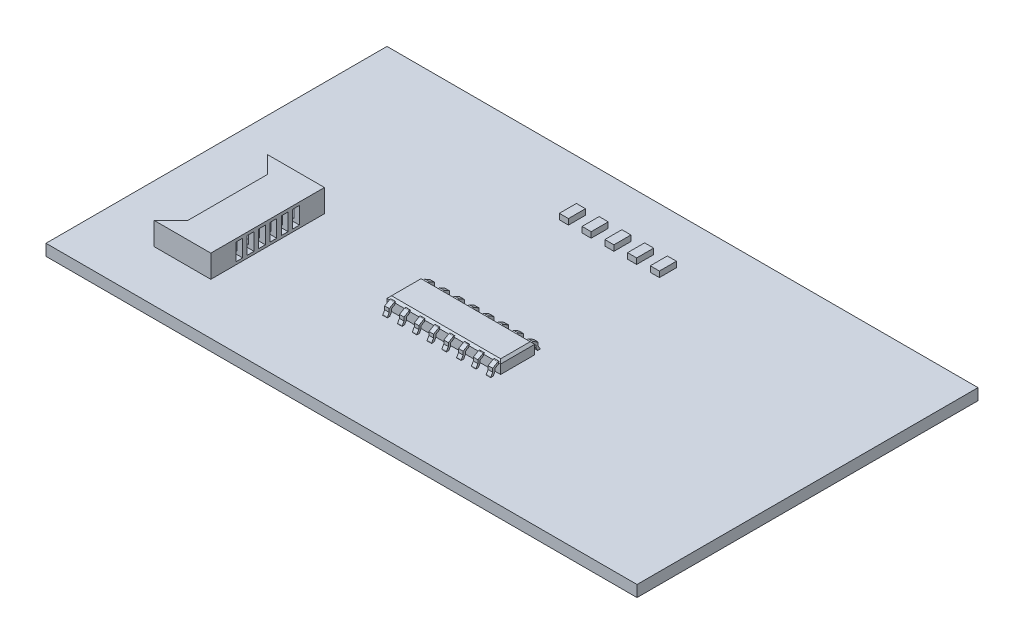
from build123d import *

# Parameters (mm, degrees)
SKETCH_1_W             = 52
SKETCH_1_H             = 30
EXTRUDE_1_DEPTH        = 1
SKETCH_2_W             = 5
SKETCH_2_H             = 10
EXTRUDE_2_DEPTH        = 2
SKETCH_4_W             = 8
SKETCH_4_H             = 1
CUT_EXTRUDE_1_DEPTH    = 4.5
CUT_EXTRUDE_2_DEPTH    = 1.5
SKETCH_5_W             = 0.6
SKETCH_5_H             = 1.5
CUT_EXTRUDE_3_DEPTH    = 6
SKETCH_6_W             = 10
SKETCH_6_H             = 3
EXTRUDE_3_DEPTH        = 1
CHAMFER_1_SIZE         = 0.2
EXTRUDE_4_DEPTH        = 0.2
EXTRUDE_4_DEPTH_BACK   = 0.2
PATTERN_LINEAR_1_COUNT = 8
PATTERN_LINEAR_1_PITCH = 1.3
SKETCH_8_W             = 0.8
SKETCH_8_H             = 1.5
EXTRUDE_5_DEPTH        = 0.5
PATTERN_LINEAR_2_COUNT = 5
PATTERN_LINEAR_2_PITCH = 2


with BuildPart() as part:
    # 草图1 → 凸台-拉伸1 (new body)
    with BuildSketch(Plane(origin=(0, 0, 0), x_dir=(1, 0, 0), z_dir=(0, 1, 0))):
        with Locations((26, 15)):
            Rectangle(SKETCH_1_W, SKETCH_1_H)
    extrude(amount=EXTRUDE_1_DEPTH)

    # 草图2 → 凸台-拉伸2 (add)
    with BuildSketch(Plane(origin=(0, 1, 0), x_dir=(1, 0, 0), z_dir=(0, 1, 0))):
        with Locations((7.5, 9.5)):
            Rectangle(SKETCH_2_W, SKETCH_2_H)
    extrude(amount=EXTRUDE_2_DEPTH)

    # 草图4 → 切除-拉伸1 (cut)
    with BuildSketch(Plane.ZY.offset(-5)):
        with Locations((-9.5, 2)):
            Rectangle(SKETCH_4_W, SKETCH_4_H)
    extrude(amount=-CUT_EXTRUDE_1_DEPTH, mode=Mode.SUBTRACT)

    # 草图3 → 切除-拉伸2 (cut)
    with BuildSketch(Plane(origin=(0, 3, 0), x_dir=(1, 0, 0), z_dir=(0, 1, 0))):
        Polygon((5, 14.5), (6.5, 13), (6.5, 6), (5, 4.5), align=None)
    extrude(amount=-CUT_EXTRUDE_2_DEPTH, mode=Mode.SUBTRACT)

    # 草图5 → 切除-拉伸3 (cut)
    with BuildSketch(Plane.ZY.offset(-5)):
        with Locations((-11, 1.985152132)):
            Rectangle(SKETCH_5_W, SKETCH_5_H)
        with Locations((-12, 1.985152132)):
            Rectangle(SKETCH_5_W, SKETCH_5_H)
        with Locations((-10, 1.985152132)):
            Rectangle(SKETCH_5_W, SKETCH_5_H)
        with Locations((-9, 1.985152132)):
            Rectangle(SKETCH_5_W, SKETCH_5_H)
        with Locations((-8, 1.985152132)):
            Rectangle(SKETCH_5_W, SKETCH_5_H)
        with Locations((-7, 1.985152132)):
            Rectangle(SKETCH_5_W, SKETCH_5_H)
    extrude(amount=-CUT_EXTRUDE_3_DEPTH, mode=Mode.SUBTRACT)

    # 草图6 → 凸台-拉伸3 (add)
    with BuildSketch(Plane(origin=(0, 1, 0), x_dir=(1, 0, 0), z_dir=(0, 1, 0))):
        with Locations((25, 11.5)):
            Rectangle(SKETCH_6_W, SKETCH_6_H)
    extrude(amount=EXTRUDE_3_DEPTH)

    # 倒角1
    chamfer_1_edges = [part.edges().sort_by_distance(p)[0] for p in [
        (30, 2, -11.5),
        (25, 2, -13),
        (20, 2, -11.5),
        (25, 2, -10),
    ]]
    chamfer(chamfer_1_edges, length=CHAMFER_1_SIZE)


with BuildPart() as body_2:
    # 草图7 → 凸台-拉伸4 (new, two sides: drawn at the far end of the back side and taken through both)
    with BuildSketch(Plane.ZY.offset(-20.5).offset(-EXTRUDE_4_DEPTH_BACK)):
        with BuildLine():
            Line((-9.95, 1.88660254), (-9.5, 1.626794919))
            Line((-9.5, 1.626794919), (-9.5, 1.326794919))
            Line((-9.5, 1.326794919), (-9.340192379, 1.05))
            ThreePointArc((-9.340192379, 1.05), (-9.376794919, 0.91339746), (-9.51339746, 0.95))
            Line((-9.51339746, 0.95), (-9.7, 1.273205081))
            Line((-9.7, 1.273205081), (-9.7, 1.511324865))
            Line((-9.7, 1.511324865), (-10.05, 1.71339746))
            ThreePointArc((-10.05, 1.71339746), (-10.08660254, 1.85), (-9.95, 1.88660254))
        make_face()
    extrude(amount=EXTRUDE_4_DEPTH + EXTRUDE_4_DEPTH_BACK)


with BuildPart() as pattern_linear_1_1:
    # 阵列(线性)1: pattern copy
    add(body_2.part.moved(Location(Vector(1, 0, 0) * (1 * PATTERN_LINEAR_1_PITCH))))


with BuildPart() as pattern_linear_1_2:
    # 阵列(线性)1: pattern copy
    add(body_2.part.moved(Location(Vector(1, 0, 0) * (2 * PATTERN_LINEAR_1_PITCH))))


with BuildPart() as pattern_linear_1_3:
    # 阵列(线性)1: pattern copy
    add(body_2.part.moved(Location(Vector(1, 0, 0) * (3 * PATTERN_LINEAR_1_PITCH))))


with BuildPart() as pattern_linear_1_4:
    # 阵列(线性)1: pattern copy
    add(body_2.part.moved(Location(Vector(1, 0, 0) * (4 * PATTERN_LINEAR_1_PITCH))))


with BuildPart() as pattern_linear_1_5:
    # 阵列(线性)1: pattern copy
    add(body_2.part.moved(Location(Vector(1, 0, 0) * (5 * PATTERN_LINEAR_1_PITCH))))


with BuildPart() as pattern_linear_1_6:
    # 阵列(线性)1: pattern copy
    add(body_2.part.moved(Location(Vector(1, 0, 0) * (6 * PATTERN_LINEAR_1_PITCH))))


with BuildPart() as pattern_linear_1_7:
    # 阵列(线性)1: pattern copy
    add(body_2.part.moved(Location(Vector(1, 0, 0) * (7 * PATTERN_LINEAR_1_PITCH))))


with BuildPart() as body_10:
    # 镜向1: mirrored copy
    add(body_2.part.mirror(Plane.XY.offset(-11.5)))


with BuildPart() as body_11:
    # Mirror 1 2: mirrored copy
    add(pattern_linear_1_1.part.mirror(Plane.XY.offset(-11.5)))


with BuildPart() as body_12:
    # Mirror 1 3: mirrored copy
    add(pattern_linear_1_2.part.mirror(Plane.XY.offset(-11.5)))


with BuildPart() as body_13:
    # Mirror 1 4: mirrored copy
    add(pattern_linear_1_3.part.mirror(Plane.XY.offset(-11.5)))


with BuildPart() as body_14:
    # Mirror 1 5: mirrored copy
    add(pattern_linear_1_4.part.mirror(Plane.XY.offset(-11.5)))


with BuildPart() as body_15:
    # Mirror 1 6: mirrored copy
    add(pattern_linear_1_5.part.mirror(Plane.XY.offset(-11.5)))


with BuildPart() as body_16:
    # Mirror 1 7: mirrored copy
    add(pattern_linear_1_6.part.mirror(Plane.XY.offset(-11.5)))


with BuildPart() as body_17:
    # Mirror 1 8: mirrored copy
    add(pattern_linear_1_7.part.mirror(Plane.XY.offset(-11.5)))


with BuildPart() as body_18:
    # 草图8 → 凸台-拉伸5 (new body)
    with BuildSketch(Plane(origin=(0, 1, 0), x_dir=(1, 0, 0), z_dir=(0, 1, 0))):
        with Locations((21.200101609, 25.115994569)):
            Rectangle(SKETCH_8_W, SKETCH_8_H)
    extrude(amount=EXTRUDE_5_DEPTH)


with BuildPart() as pattern_linear_2_1:
    # 阵列(线性)2: pattern copy
    add(body_18.part.moved(Location(Vector(1, 0, 0) * (1 * PATTERN_LINEAR_2_PITCH))))


with BuildPart() as pattern_linear_2_2:
    # 阵列(线性)2: pattern copy
    add(body_18.part.moved(Location(Vector(1, 0, 0) * (2 * PATTERN_LINEAR_2_PITCH))))


with BuildPart() as pattern_linear_2_3:
    # 阵列(线性)2: pattern copy
    add(body_18.part.moved(Location(Vector(1, 0, 0) * (3 * PATTERN_LINEAR_2_PITCH))))


with BuildPart() as pattern_linear_2_4:
    # 阵列(线性)2: pattern copy
    add(body_18.part.moved(Location(Vector(1, 0, 0) * (4 * PATTERN_LINEAR_2_PITCH))))


solid = Compound([part.part, body_2.part, pattern_linear_1_1.part, pattern_linear_1_2.part, pattern_linear_1_3.part, pattern_linear_1_4.part, pattern_linear_1_5.part, pattern_linear_1_6.part, pattern_linear_1_7.part, body_10.part, body_11.part, body_12.part, body_13.part, body_14.part, body_15.part, body_16.part, body_17.part, body_18.part, pattern_linear_2_1.part, pattern_linear_2_2.part, pattern_linear_2_3.part, pattern_linear_2_4.part])
